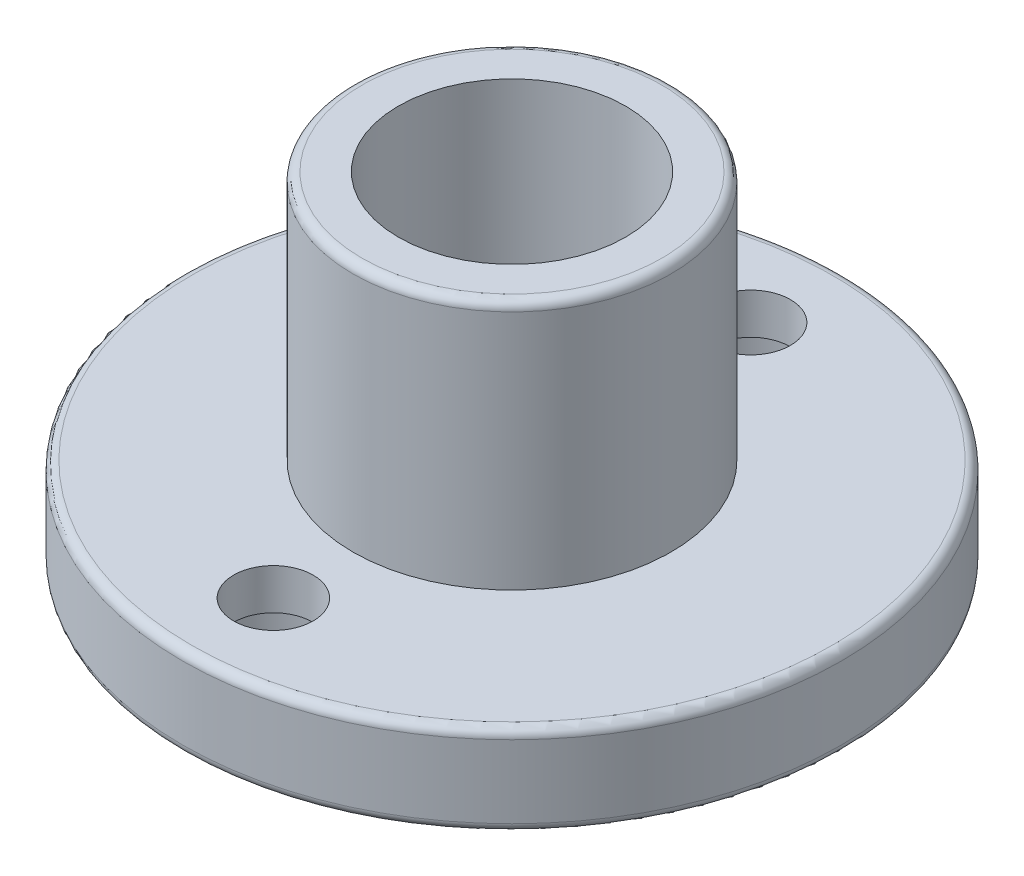
from build123d import *

# Parameters (mm, degrees)
SKETCH_1_R          = 14.5
SKETCH_1_R_2        = 7
EXTRUDE_1_DEPTH     = 4
SKETCH_1_3_R        = 7
SKETCH_1_3_R_2      = 5
EXTRUDE_2_DEPTH     = 15
SKETCH_2_R          = 3
SKETCH_2_R_2        = 1.75
CUT_EXTRUDE_1_DEPTH = 2.2
SKETCH_2_4_R        = 1.75
CUT_EXTRUDE_2_DEPTH = 26.406692032
FILLET_1_R          = 0.4


with BuildPart() as part:
    # 草图1 → 凸台-拉伸1 (new body)
    with BuildSketch(Plane(origin=(0, 0, 0), x_dir=(1, 0, 0), z_dir=(0, 1, 0))):
        Circle(SKETCH_1_R)
        Circle(SKETCH_1_R_2, mode=Mode.SUBTRACT)
    extrude(amount=EXTRUDE_1_DEPTH)

    # 草图1<3> → 凸台-拉伸2 (add)
    with BuildSketch(Plane(origin=(0, 0, 0), x_dir=(1, 0, 0), z_dir=(0, 1, 0))):
        Circle(SKETCH_1_3_R)
        Circle(SKETCH_1_3_R_2, mode=Mode.SUBTRACT)
    extrude(amount=EXTRUDE_2_DEPTH)

    # 草图2 → 切除-拉伸1 (cut)
    # profile 1 of 2: a face of its own
    with BuildSketch(Plane.XZ):
        with Locations((0, 10.5)):
            Circle(SKETCH_2_R)
        with Locations((0, 10.5)):
            Circle(SKETCH_2_R_2, mode=Mode.SUBTRACT)
    # profile 2 of 2: a face of its own
    with BuildSketch(Plane.XZ):
        with Locations((0, -10.5)):
            Circle(SKETCH_2_R)
        with Locations((0, -10.5)):
            Circle(SKETCH_2_R_2, mode=Mode.SUBTRACT)
    extrude(amount=-CUT_EXTRUDE_1_DEPTH, mode=Mode.SUBTRACT)

    # 草图2<4> → 切除-拉伸2 (cut, through all)
    with BuildSketch(Plane.XZ):
        with Locations((0, 10.5)):
            Circle(SKETCH_2_4_R)
        with Locations((0, -10.5)):
            Circle(SKETCH_2_4_R)
    extrude(amount=-CUT_EXTRUDE_2_DEPTH, mode=Mode.SUBTRACT)

    # 圆角1
    fillet_1_edges = [part.edges().sort_by_distance(p)[0] for p in [
        (-14.5, 0, 0),
        (-14.5, 4, 0),
        (-7, 15, 0),
    ]]
    fillet(fillet_1_edges, radius=FILLET_1_R)


solid = part.part
